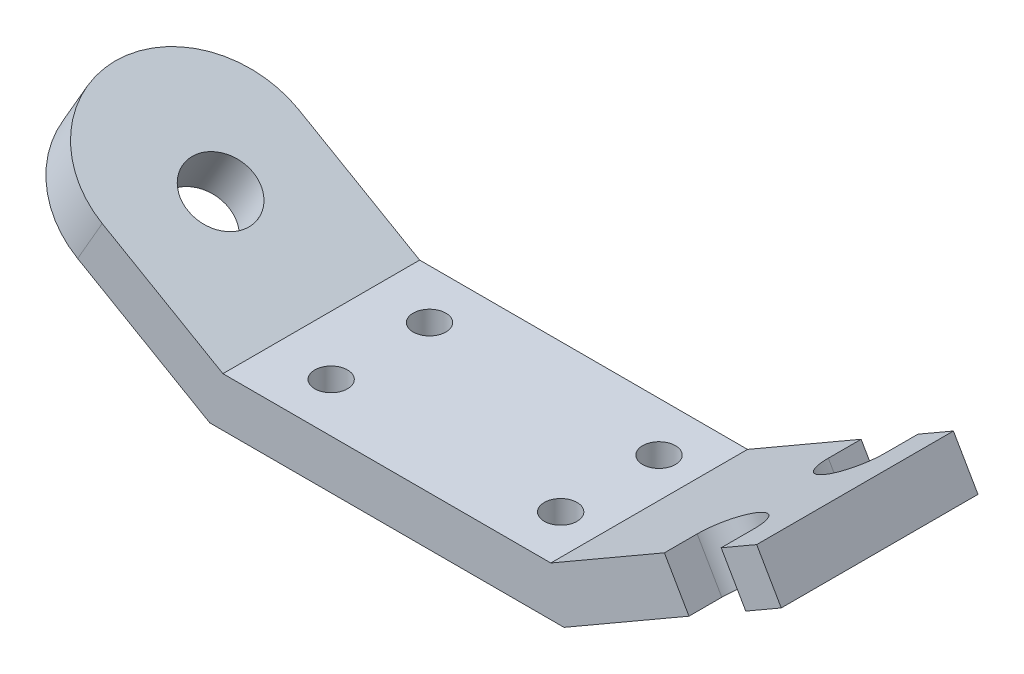
from build123d import *

# Parameters (mm, degrees)
EXTRUDE_1_DEPTH     = 24
FILLET_1_RADIUS     = 24
FILLET_1_LENGTH     = 12
SKETCH_3_R          = 8
CUT_EXTRUDE_2_DEPTH = 142.334600959
SKETCH_4_R          = 4
CUT_EXTRUDE_3_DEPTH = 142.334600959
CUT_EXTRUDE_4_DEPTH = 135.667997045


with BuildPart() as part:
    # 草圖1 → 伸長-薄件1 (new, symmetric)
    with BuildSketch(Plane.XY):
        Polygon((130.229473419, 29), (80, 0), (0, 0), (-50.229473419, 29), (-56.229473419, 18.607695155), (-3.215390309, -12), (83.215390309, -12), (136.229473419, 18.607695155), align=None)
    extrude(amount=EXTRUDE_1_DEPTH, both=True)

    # 圓角1: full round fillet: the end face becomes a half cylinder, R = half its width
    fillet_1_face = Plane((-53.229473419, 23.803847577, 0), x_dir=(0.5, 0.866025403784, 0), z_dir=(-0.866025403784, 0.5, 0))  # on the end face: x along it, z out of the body
    fillet_1_slab = fillet_1_face.offset(-FILLET_1_RADIUS / 2) * Box(FILLET_1_LENGTH, 2 * FILLET_1_RADIUS, FILLET_1_RADIUS, mode=Mode.PRIVATE)  # the body's end, R deep
    fillet_1_round = Plane((-32.444863728, 11.803847577, 0), x_dir=(-0.866025403784, 0.5, 0), z_dir=(0.5, 0.866025403784, 0)) * Cylinder(FILLET_1_RADIUS, FILLET_1_LENGTH, mode=Mode.PRIVATE)  # its axis R under the face
    add(fillet_1_slab - fillet_1_round, mode=Mode.SUBTRACT)

    # 草圖3 → 除料-伸長2 (cut, through all)
    with BuildSketch(Plane(origin=(0, 0, 0), x_dir=(0.8660254037844416, -0.49999999999999484, 0), z_dir=(0.49999999999999484, 0.8660254037844416, 0))):
        with Locations(Location((-28.36733721, 0, 0), (0, 0, 180))):
            Circle(SKETCH_3_R)
    extrude(amount=-CUT_EXTRUDE_2_DEPTH, mode=Mode.SUBTRACT)

    # 草圖4 → 除料-伸長3 (cut, through all)
    with BuildSketch(Plane(origin=(0, 0, 0), x_dir=(1, 0, 0), z_dir=(0, 1, 0))):
        with Locations(Location((14.406554247, -12, 0), (0, 0, 270))):
            Circle(SKETCH_4_R)
        with Locations(Location((70.406554247, -12, 0), (0, 0, 270))):
            Circle(SKETCH_4_R)
        with Locations(Location((70.406554247, 12, 0), (0, 0, 90))):
            Circle(SKETCH_4_R)
        with Locations(Location((14.406554247, 12, 0), (0, 0, 90))):
            Circle(SKETCH_4_R)
    extrude(amount=-CUT_EXTRUDE_3_DEPTH, mode=Mode.SUBTRACT)

    # 草圖5 → 除料-伸長4 (cut, through all)
    with BuildSketch(Plane(origin=(20, -34.641016151, 0), x_dir=(0.866025403784438, 0.500000000000001, 0), z_dir=(-0.500000000000001, 0.866025403784438, 0))):
        with BuildLine():
            Line((101.282032303, -24), (101.282032303, -16))
            ThreePointArc((101.282032303, -16), (109.282032303, -8), (117.282032303, -16))
            Line((117.282032303, -16), (117.282032303, -24))
            Line((117.282032303, -24), (101.282032303, -24))
        make_face()
        with BuildLine():
            Line((117.282032303, 24), (101.282032303, 24))
            Line((101.282032303, 24), (101.282032303, 16))
            ThreePointArc((101.282032303, 16), (109.282032303, 8), (117.282032303, 16))
            Line((117.282032303, 16), (117.282032303, 24))
        make_face()
    extrude(amount=-CUT_EXTRUDE_4_DEPTH, mode=Mode.SUBTRACT)


solid = part.part
